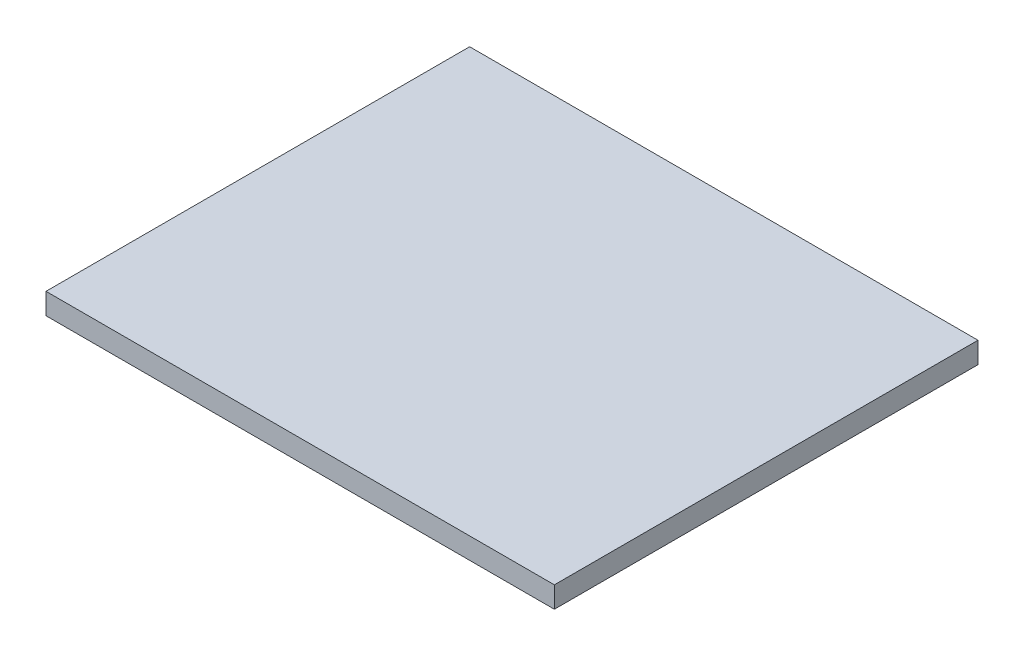
from build123d import *

# Parameters (mm, degrees)
SKETCH1_W           = 120
SKETCH1_H           = 100
BOSS_EXTRUDE1_DEPTH = 5


with BuildPart() as part:
    # Sketch1 → Boss-Extrude1 (new body)
    with BuildSketch(Plane(origin=(0, 0, 0), x_dir=(1, 0, 0), z_dir=(0, 1, 0))):
        Rectangle(SKETCH1_W, SKETCH1_H)
    extrude(amount=BOSS_EXTRUDE1_DEPTH)


solid = part.part
